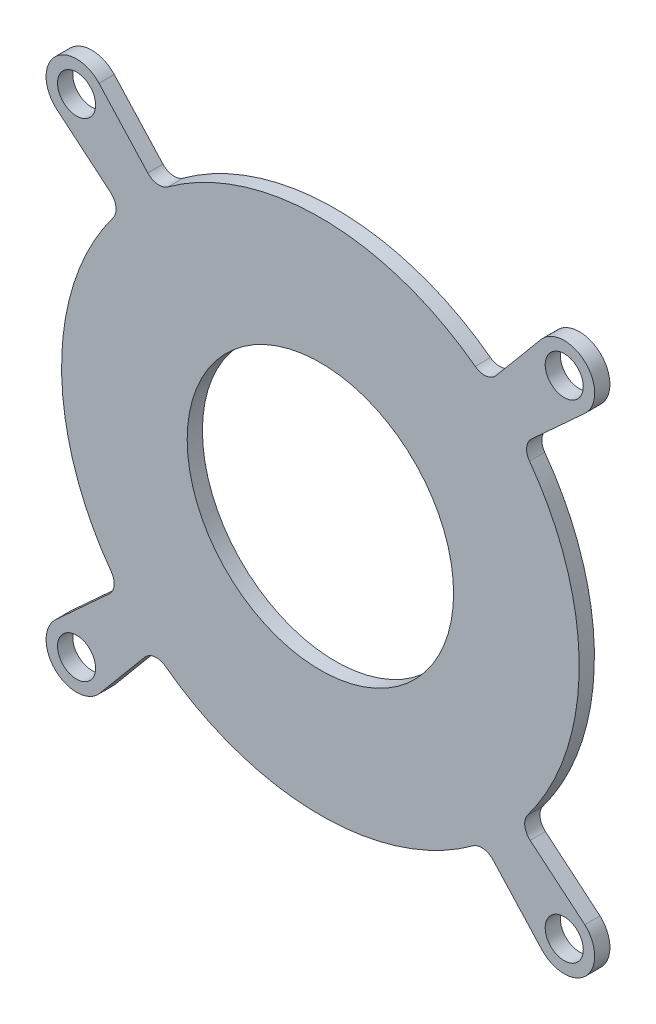
from build123d import *

# Parameters (mm, degrees)
SKETCH_1_R      = 2.5
SKETCH_1_R_2    = 17.5
EXTRUDE_1_DEPTH = 2


with BuildPart() as part:
    # 草图1 → 凸台-拉伸1 (new body)
    with BuildSketch(Plane.XY):
        with BuildLine():
            Line((29.084941375, -34.299138035), (22.681496979, -27.303615871))
            ThreePointArc((22.681496979, -27.303615871), (21.405560026, -26.66397773), (20.028107344, -27.037844244))
            ThreePointArc((20.028107344, -27.037844244), (-0.197152183, -33.562285535), (-20.34538772, -26.803730817))
            ThreePointArc((-20.34538772, -26.803730817), (-21.773876316, -26.419601836), (-23.075616614, -27.122173496))
            Line((-23.075616614, -27.122173496), (-29.084941375, -34.299138035))
            ThreePointArc((-29.084941375, -34.299138035), (-34.863899846, -34.426756989), (-34.736280892, -28.647798518))
            Line((-34.736280892, -28.647798518), (-27.740758728, -22.244354122))
            ThreePointArc((-27.740758728, -22.244354122), (-27.101120587, -20.968417169), (-27.474987101, -19.590964487))
            ThreePointArc((-27.474987101, -19.590964487), (-33.999428392, 0.634295041), (-27.240873674, 20.782530577))
            ThreePointArc((-27.240873674, 20.782530577), (-26.856744694, 22.211019173), (-27.559316353, 23.512759472))
            Line((-27.559316353, 23.512759472), (-34.736280892, 29.522084232))
            ThreePointArc((-34.736280892, 29.522084232), (-34.863899846, 35.301042704), (-29.084941375, 35.173423749))
            Line((-29.084941375, 35.173423749), (-22.681496979, 28.177901585))
            ThreePointArc((-22.681496979, 28.177901585), (-21.405560026, 27.538263444), (-20.028107344, 27.912129958))
            ThreePointArc((-20.028107344, 27.912129958), (0.197152183, 34.43657125), (20.34538772, 27.678016531))
            ThreePointArc((20.34538772, 27.678016531), (21.773876316, 27.293887551), (23.075616614, 27.99645921))
            Line((23.075616614, 27.99645921), (29.084941375, 35.173423749))
            ThreePointArc((29.084941375, 35.173423749), (34.863899846, 35.301042704), (34.736280892, 29.522084232))
            Line((34.736280892, 29.522084232), (27.740758728, 23.118639836))
            ThreePointArc((27.740758728, 23.118639836), (27.101120587, 21.842702883), (27.474987101, 20.465250201))
            ThreePointArc((27.474987101, 20.465250201), (33.999428392, 0.239990674), (27.240873674, -19.908244863))
            ThreePointArc((27.240873674, -19.908244863), (26.856744694, -21.336733459), (27.559316353, -22.638473757))
            Line((27.559316353, -22.638473757), (34.736280892, -28.647798518))
            ThreePointArc((34.736280892, -28.647798518), (34.863899846, -34.426756989), (29.084941375, -34.299138035))
        make_face()
        with Locations((32.035472722, -31.598329865)):
            Circle(SKETCH_1_R, mode=Mode.SUBTRACT)
        with Locations((-32.035472722, -31.598329865)):
            Circle(SKETCH_1_R, mode=Mode.SUBTRACT)
        with Locations((-32.035472722, 32.472615579)):
            Circle(SKETCH_1_R, mode=Mode.SUBTRACT)
        with Locations((32.035472722, 32.472615579)):
            Circle(SKETCH_1_R, mode=Mode.SUBTRACT)
        with Locations((0, 0.437142857)):
            Circle(SKETCH_1_R_2, mode=Mode.SUBTRACT)
    extrude(amount=EXTRUDE_1_DEPTH)


solid = part.part
